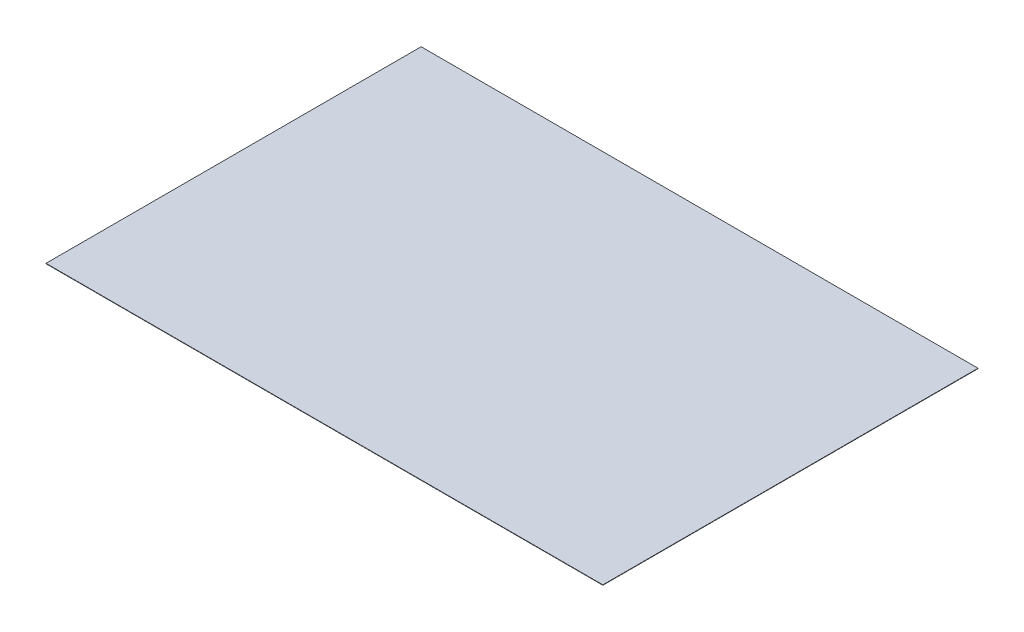
from build123d import *

# Parameters (mm, degrees)
SKETCH_1_W      = 148
SKETCH_1_H      = 99.7
EXTRUDE_1_DEPTH = 0.1


with BuildPart() as part:
    # 草图1 → 凸台-拉伸1 (new body)
    with BuildSketch(Plane(origin=(0, 0, 0), x_dir=(1, 0, 0), z_dir=(0, 1, 0))):
        Rectangle(SKETCH_1_W, SKETCH_1_H)
    extrude(amount=EXTRUDE_1_DEPTH)


solid = part.part
